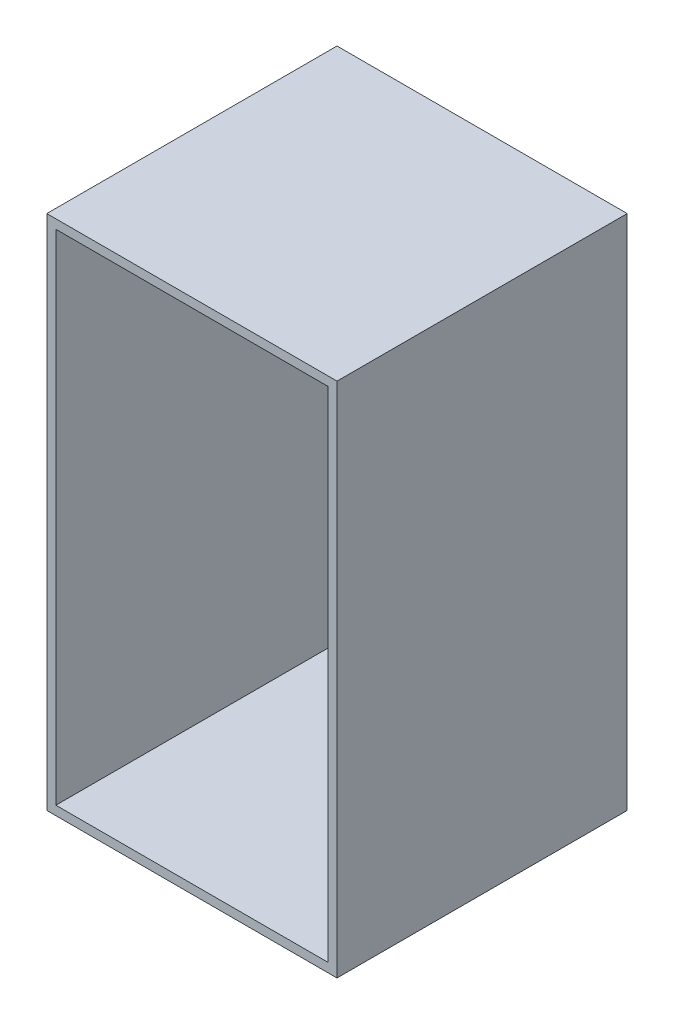
from build123d import *

# Parameters (mm, degrees)
SKETCH1_W           = 640
SKETCH1_H           = 1140
BOSS_EXTRUDE1_DEPTH = 640
SHELL1_T            = -20


with BuildPart() as part:
    # Sketch1 → Boss-Extrude1 (new body)
    with BuildSketch(Plane.XY):
        Rectangle(SKETCH1_W, SKETCH1_H)
    extrude(amount=BOSS_EXTRUDE1_DEPTH)

    # Shell1
    shell1_openings = [part.faces().sort_by_distance(p)[0] for p in [
        (0, 0, 640),
    ]]
    offset(amount=SHELL1_T, openings=shell1_openings, kind=Kind.INTERSECTION)


solid = part.part
